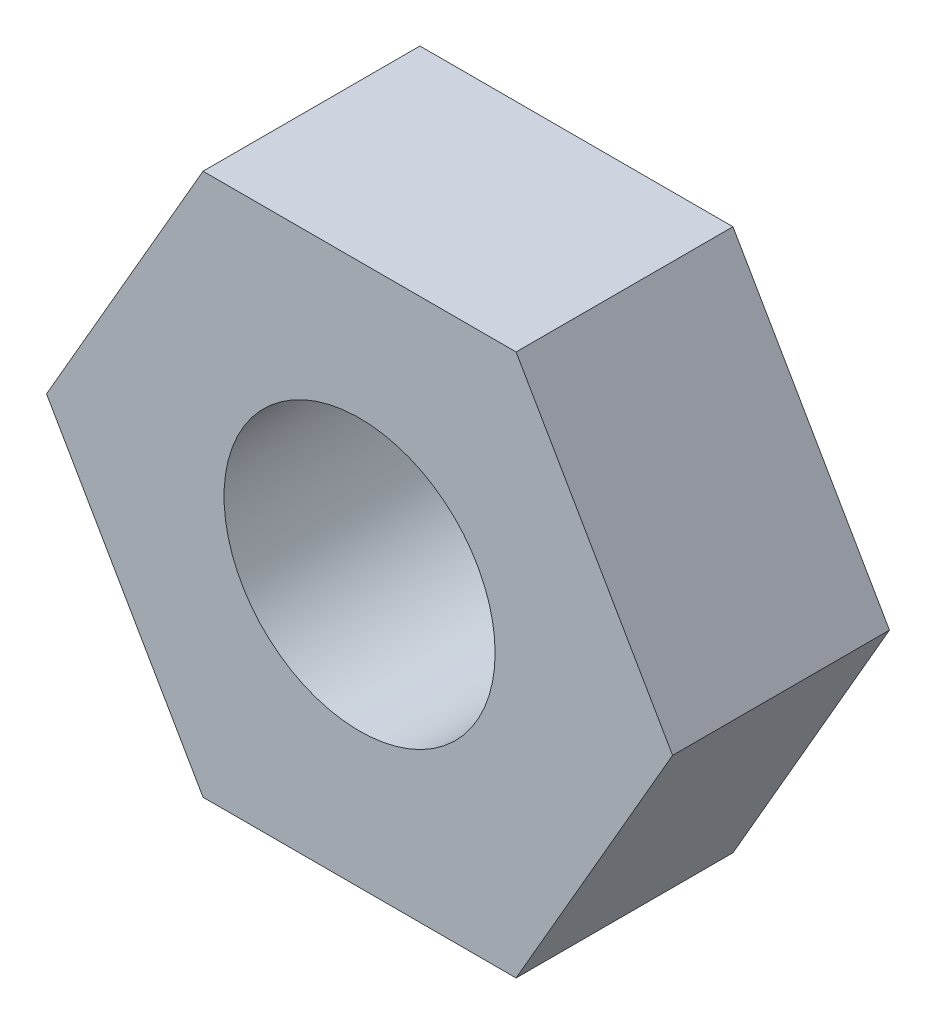
from build123d import *

# Parameters (mm, degrees)
SKETCH_1_R        = 1
EXTRUDE_210_DEPTH = 1.6


with BuildPart() as part:
    # 草图1 → Extrude 210 (new body)
    with BuildSketch(Plane.XY):
        Polygon((2.309401077, 0), (1.154700538, 2), (-1.154700538, 2), (-2.309401077, 0), (-1.154700538, -2), (1.154700538, -2), align=None)
        Circle(SKETCH_1_R, mode=Mode.SUBTRACT)
    extrude(amount=EXTRUDE_210_DEPTH)


solid = part.part
